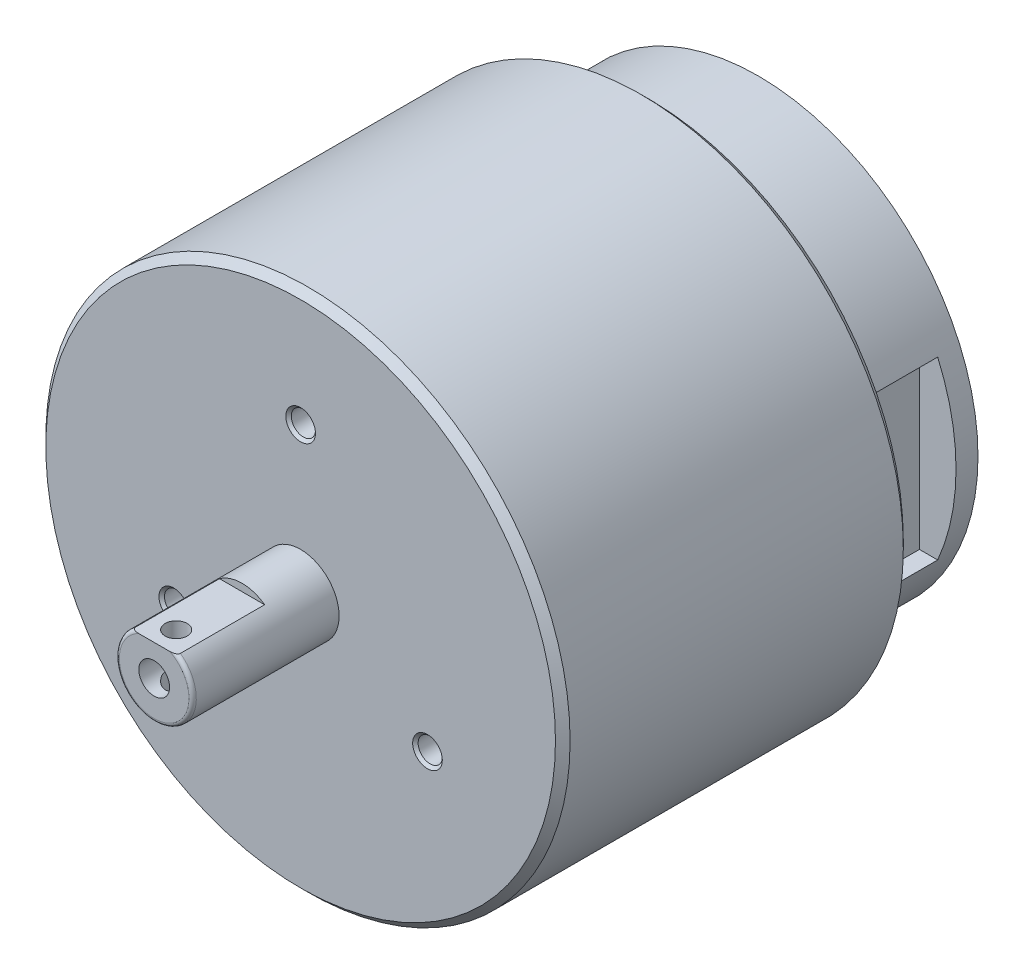
from build123d import *

# Parameters (mm, degrees)
SKETCH_1_R                   = 35.8
EXTRUDE_1_DEPTH              = 47.5
HOLE_WIZARD_M4_1_D           = 3.3
HOLE_WIZARD_M4_1_DEPTH       = 10.1
HOLE_WIZARD_M4_1_CSINK_D     = 4.05
HOLE_WIZARD_M4_1_CSINK_ANGLE = 90
HOLE_WIZARD_M4_1_TIP         = 0.991420021
CHAMFER_1_SIZE               = 1
SKETCH_8_R                   = 30
EXTRUDE_2_DEPTH              = 16
SKETCH_9_R                   = 5.25
EXTRUDE_3_DEPTH              = 20
FILLET_1_R                   = 0.5
HOLE_WIZARD_M5_1_D           = 4.2
HOLE_WIZARD_M5_1_DEPTH       = 12.4
HOLE_WIZARD_M5_1_TIP         = 1.2618073
CUT_EXTRUDE_START            = -12
CUT_EXTRUDE_1_DEPTH          = 12
SKETCH_14_R                  = 1.5
CUT_EXTRUDE_2_DEPTH          = 87.266404315
SKETCH_15_W                  = 12
SKETCH_15_H                  = 24
CUT_EXTRUDE_3_DEPTH          = 5
CHAMFER_2_SIZE               = 1
CHAMFER_2_SIZE2              = 3


with BuildPart() as part:
    # 草图1 → 凸台-拉伸1 (new body)
    with BuildSketch(Plane.XY):
        Circle(SKETCH_1_R)
    extrude(amount=EXTRUDE_1_DEPTH)

    # M4 螺纹孔1
    with Locations(Plane.XY.offset(47.5)):
        with Locations((0, 20), (17.320508076, -10), (-17.320508076, -10)):
            CounterSinkHole(HOLE_WIZARD_M4_1_D / 2, HOLE_WIZARD_M4_1_CSINK_D / 2, depth=HOLE_WIZARD_M4_1_DEPTH, counter_sink_angle=HOLE_WIZARD_M4_1_CSINK_ANGLE)
            with Locations((0, 0, -(HOLE_WIZARD_M4_1_DEPTH + HOLE_WIZARD_M4_1_TIP / 2))):  # 118° drill point
                Cone(0, HOLE_WIZARD_M4_1_D / 2, HOLE_WIZARD_M4_1_TIP, mode=Mode.SUBTRACT)

    # 倒角1
    chamfer_1_edges = [part.edges().sort_by_distance(p)[0] for p in [
        (-35.8, 0, 0),
        (-35.8, 0, 47.5),
    ]]
    chamfer(chamfer_1_edges, length=CHAMFER_1_SIZE)

    # 草图8 → 凸台-拉伸2 (add)
    with BuildSketch(Plane(origin=(0, 0, 0), x_dir=(-1, 0, 0), z_dir=(0, 0, -1))):
        with Locations(Location((0, 0, 0), (0, 0, 180))):
            Circle(SKETCH_8_R)
    extrude(amount=EXTRUDE_2_DEPTH)

    # 草图9 → 凸台-拉伸3 (add)
    with BuildSketch(Plane.XY.offset(47.5)):
        Circle(SKETCH_9_R)
    extrude(amount=EXTRUDE_3_DEPTH)

    # 圆角1
    fillet_1_edges = [part.edges().sort_by_distance(p)[0] for p in [
        (-5.25, 0, 67.5),
    ]]
    fillet(fillet_1_edges, radius=FILLET_1_R)

    # M5 螺纹孔1
    with Locations(Plane.XY.offset(67.5)):
        with Locations((0, 0)):
            Hole(HOLE_WIZARD_M5_1_D / 2, depth=HOLE_WIZARD_M5_1_DEPTH)
            with Locations((0, 0, -(HOLE_WIZARD_M5_1_DEPTH + HOLE_WIZARD_M5_1_TIP / 2))):  # 118° drill point
                Cone(0, HOLE_WIZARD_M5_1_D / 2, HOLE_WIZARD_M5_1_TIP, mode=Mode.SUBTRACT)

    # 草图13 → 切除-拉伸1 (cut)
    with BuildSketch(Plane.XY.offset(67.5).offset(CUT_EXTRUDE_START)):
        with BuildLine():
            Line((-3.082207001, 4.25), (3.082207001, 4.25))
            ThreePointArc((3.082207001, 4.25), (0, 5.25), (-3.082207001, 4.25))
        make_face()
    extrude(amount=CUT_EXTRUDE_1_DEPTH, mode=Mode.SUBTRACT)

    # 草图14 → 切除-拉伸2 (cut, through all)
    with BuildSketch(Plane(origin=(0, 4.25, 0), x_dir=(1, 0, 0), z_dir=(0, 1, 0))):
        with Locations(Location((0, -64.5, 0), (0, 0, 270))):
            Circle(SKETCH_14_R)
    extrude(amount=-CUT_EXTRUDE_2_DEPTH, mode=Mode.SUBTRACT)

    # 草图15 → 切除-拉伸3 (cut)
    with BuildSketch(Plane(origin=(30, 0, 0), x_dir=(0, 0, -1), z_dir=(1, 0, 0))):
        with Locations((6, 0)):
            Rectangle(SKETCH_15_W, SKETCH_15_H)
    extrude(amount=-CUT_EXTRUDE_3_DEPTH, mode=Mode.SUBTRACT)

    # 倒角2
    chamfer_2_edges = [part.edges().sort_by_distance(p)[0] for p in [
        (-30, 0, -16),
    ]]
    chamfer_2_side = [part.faces().sort_by_distance(p)[0] for p in [
        (-30, 0, -8),
    ]]
    chamfer(chamfer_2_edges, length=CHAMFER_2_SIZE, length2=CHAMFER_2_SIZE2, reference=chamfer_2_side[0])


solid = part.part
